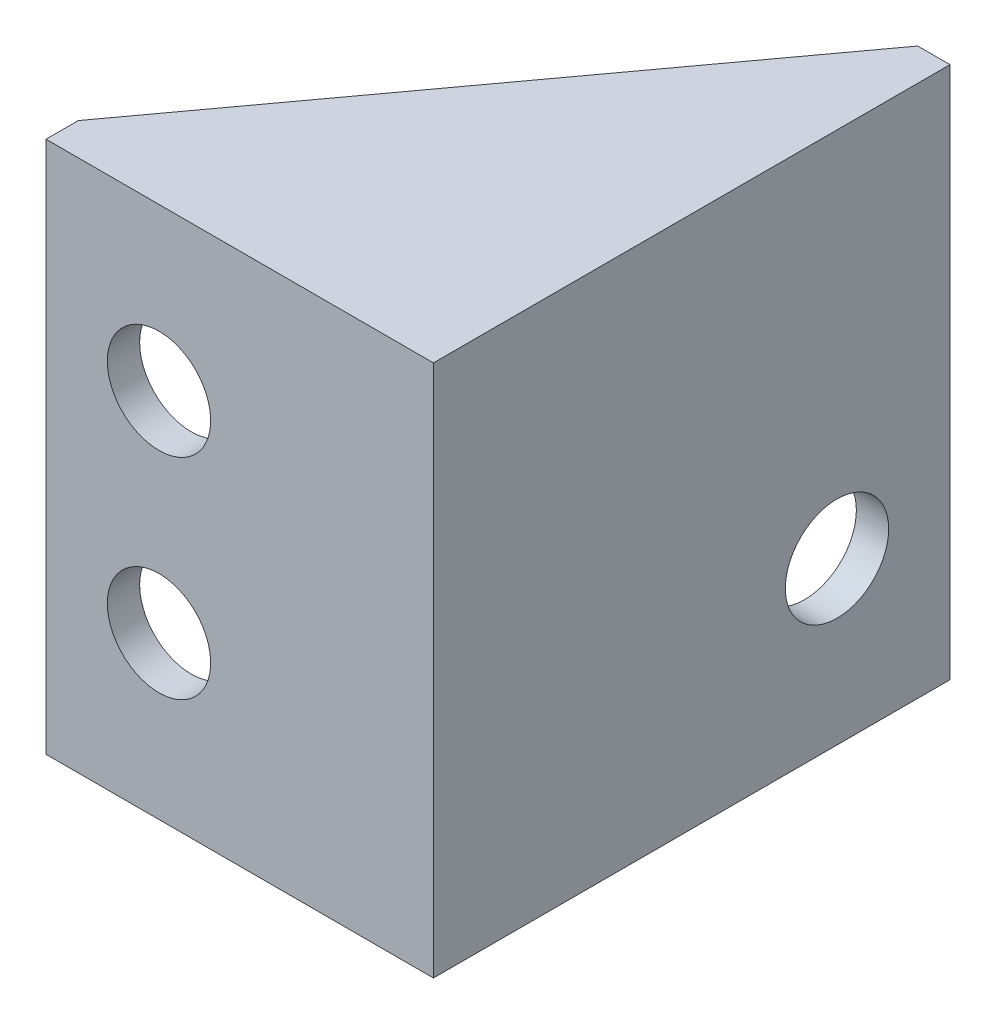
from build123d import *

# Parameters (mm, degrees)
EXTRUDE_1_DEPTH     = 16.5
SKETCH_2_R          = 1.6
CUT_EXTRUDE_1_DEPTH = 6
SKETCH_3_R          = 1.6
CUT_EXTRUDE_2_DEPTH = 10
EXTRUDE_2_DEPTH     = 1
EXTRUDE_3_DEPTH     = 1


with BuildPart() as part:
    # 草图1 → 凸台-拉伸1 (new body)
    with BuildSketch(Plane(origin=(0, 0, 0), x_dir=(1, 0, 0), z_dir=(0, 1, 0))):
        Polygon((0, 0), (12, 0), (12, 16), (11, 16), (11, 1), (0, 1), align=None)
    extrude(amount=EXTRUDE_1_DEPTH)

    # 草图2 → 切除-拉伸1 (cut)
    with BuildSketch(Plane(origin=(12, 0, 0), x_dir=(0, 0, -1), z_dir=(1, 0, 0))):
        with Locations((12.5, 5)):
            Circle(SKETCH_2_R)
    extrude(amount=-CUT_EXTRUDE_1_DEPTH, mode=Mode.SUBTRACT)

    # 草图3 → 切除-拉伸2 (cut)
    with BuildSketch(Plane(origin=(0, 0, -1), x_dir=(-1, 0, 0), z_dir=(0, 0, -1))):
        with Locations((-3.5, 5)):
            Circle(SKETCH_3_R)
        with Locations((-3.5, 11.5)):
            Circle(SKETCH_3_R)
    extrude(amount=-CUT_EXTRUDE_2_DEPTH, mode=Mode.SUBTRACT)

    # 草图4 → 凸台-拉伸2 (add)
    with BuildSketch(Plane.XZ):
        Polygon((0, -1), (11, -1), (11, -16), align=None)
    extrude(amount=-EXTRUDE_2_DEPTH)

    # 草图5 → 凸台-拉伸3 (add)
    with BuildSketch(Plane(origin=(0, 16.5, 0), x_dir=(1, 0, 0), z_dir=(0, 1, 0))):
        Polygon((0, 1), (11, 1), (11, 16), align=None)
    extrude(amount=-EXTRUDE_3_DEPTH)


solid = part.part
